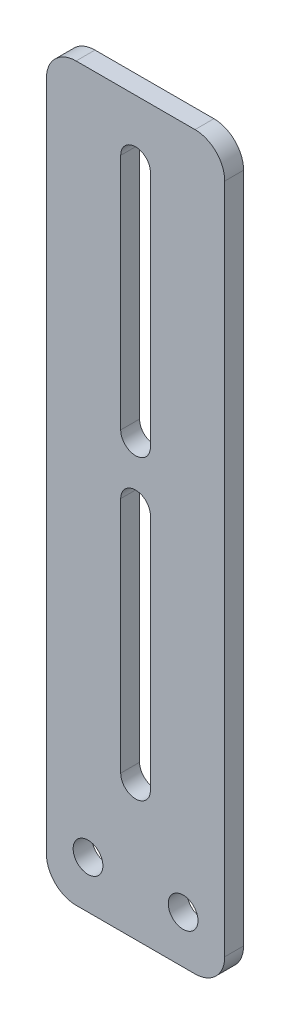
from build123d import *

# Parameters (mm, degrees)
SKETCH1_W           = 30
SKETCH1_H           = 123
SKETCH1_R           = 2.5
BOSS_EXTRUDE1_DEPTH = 3.175
FILLET2_R           = 5


with BuildPart() as part:
    # Sketch1 → Boss-Extrude1 (new body)
    with BuildSketch(Plane.XY):
        with Locations((0, 61.5)):
            Rectangle(SKETCH1_W, SKETCH1_H)
        with Locations((-8, 8)):
            Circle(SKETCH1_R, mode=Mode.SUBTRACT)
        with Locations(Location((8, 8, 0), (0, 0, 180))):
            Circle(SKETCH1_R, mode=Mode.SUBTRACT)
        with BuildLine():
            Line((2.5, 113), (2.5, 73))
            ThreePointArc((2.5, 73), (0, 70.5), (-2.5, 73))
            Line((-2.5, 73), (-2.5, 113))
            ThreePointArc((-2.5, 113), (0, 115.5), (2.5, 113))
        make_face(mode=Mode.SUBTRACT)
        with BuildLine():
            Line((-2.5, 63), (-2.5, 23))
            ThreePointArc((-2.5, 23), (0, 20.5), (2.5, 23))
            Line((2.5, 23), (2.5, 63))
            ThreePointArc((2.5, 63), (0, 65.5), (-2.5, 63))
        make_face(mode=Mode.SUBTRACT)
    extrude(amount=BOSS_EXTRUDE1_DEPTH)

    # Fillet2
    fillet2_edges = [part.edges().sort_by_distance(p)[0] for p in [
        (15, 123, 1.5875),
        (15, 0, 1.5875),
        (-15, 0, 1.5875),
        (-15, 123, 1.5875),
    ]]
    fillet(fillet2_edges, radius=FILLET2_R)


solid = part.part
